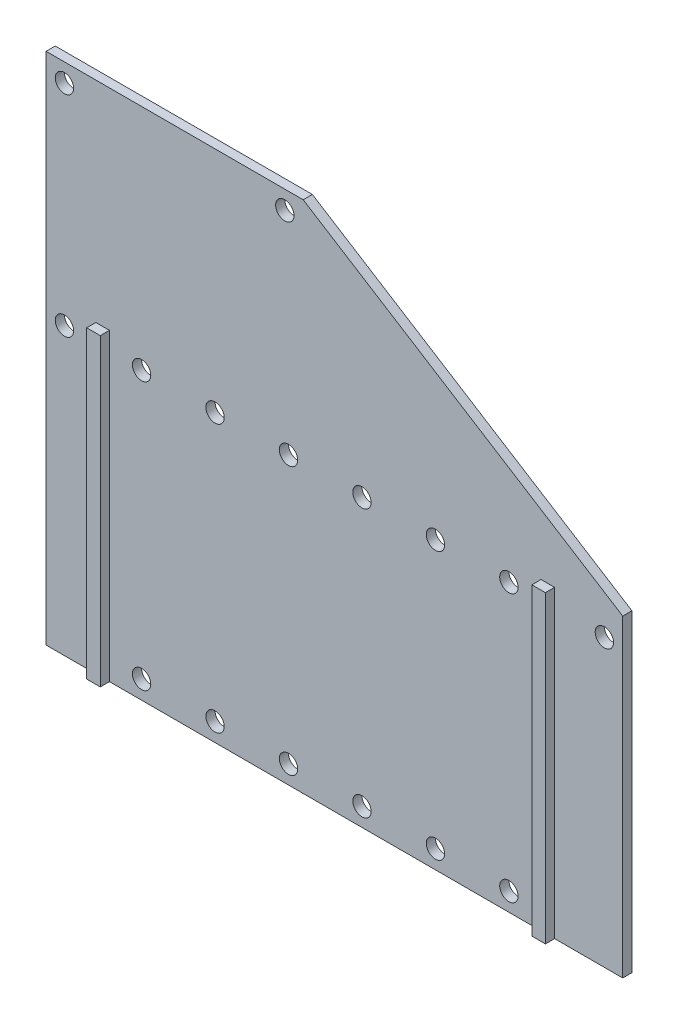
from build123d import *

# Parameters (mm, degrees)
SKETCH1_W           = 199.39
SKETCH1_H           = 177.8
BOSS_EXTRUDE1_DEPTH = 3.175
CUT_EXTRUDE4_DEPTH  = 134.612812447
SKETCH7_R           = 3.175
CUT_EXTRUDE5_DEPTH  = 134.612812447
SKETCH8_W           = 4.699
SKETCH8_H           = 105.199999912
BOSS_EXTRUDE2_DEPTH = 3.175


with BuildPart() as part:
    # Sketch1 → Boss-Extrude1 (new body)
    with BuildSketch(Plane.XY):
        Rectangle(SKETCH1_W, SKETCH1_H)
    extrude(amount=BOSS_EXTRUDE1_DEPTH)

    # Sketch6 → Cut-Extrude4 (cut, through all)
    with BuildSketch(Plane.XY.offset(3.175)):
        Polygon((99.695, 88.9), (99.695, 19.474999912), (-10.795, 88.9), align=None)
    extrude(amount=-CUT_EXTRUDE4_DEPTH, mode=Mode.SUBTRACT)

    # Sketch7 → Cut-Extrude5 (cut, through all)
    with BuildSketch(Plane.XY.offset(3.175)):
        with Locations((-93.345, 82.55)):
            Circle(SKETCH7_R)
        with Locations((-93.345, 9.949999912)):
            Circle(SKETCH7_R)
        with Locations((93.345, 9.949999912)):
            Circle(SKETCH7_R)
        with Locations((-66.675, 9.949999912)):
            Circle(SKETCH7_R)
        with Locations((-41.275, 9.949999912)):
            Circle(SKETCH7_R)
        with Locations((-15.875, 9.949999912)):
            Circle(SKETCH7_R)
        with Locations((9.525, 9.949999912)):
            Circle(SKETCH7_R)
        with Locations((34.925, 9.949999912)):
            Circle(SKETCH7_R)
        with Locations((60.325, 9.949999912)):
            Circle(SKETCH7_R)
        with Locations((-17.145, 82.55)):
            Circle(SKETCH7_R)
        with Locations((-66.675, -82.55)):
            Circle(SKETCH7_R)
        with Locations((-41.275, -82.55)):
            Circle(SKETCH7_R)
        with Locations((-15.875, -82.55)):
            Circle(SKETCH7_R)
        with Locations((9.525, -82.55)):
            Circle(SKETCH7_R)
        with Locations((34.925, -82.55)):
            Circle(SKETCH7_R)
        with Locations((60.325, -82.55)):
            Circle(SKETCH7_R)
    extrude(amount=-CUT_EXTRUDE5_DEPTH, mode=Mode.SUBTRACT)

    # Sketch8 → Boss-Extrude2 (add)
    with BuildSketch(Plane.XY.offset(3.175)):
        with Locations((-80.137, -36.300000044)):
            Rectangle(SKETCH8_W, SKETCH8_H)
        with Locations((73.787, -36.300000044)):
            Rectangle(SKETCH8_W, SKETCH8_H)
    extrude(amount=BOSS_EXTRUDE2_DEPTH)


solid = part.part
